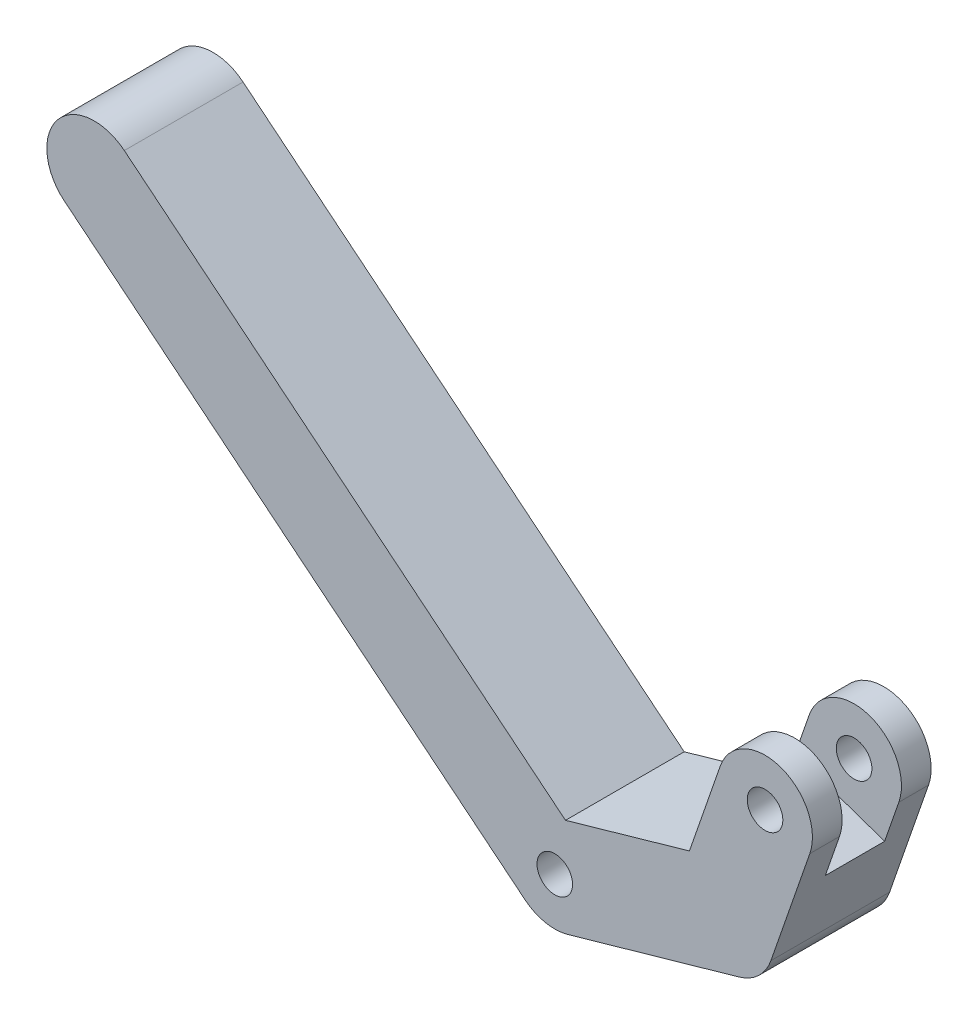
from build123d import *

# Parameters (mm, degrees)
Y_KSEKLIK_EKSTR_ZYON1_DEPTH = 5
IZIM2_R                     = 1.5
KES_EKSTR_ZYON1_DEPTH       = 15
KES_EKSTR_ZYON2_DEPTH       = 2.5


with BuildPart() as part:
    # Çizim1 → Yükseklik-Ekstrüzyon1 (new, symmetric)
    with BuildSketch(Plane.XY):
        with BuildLine():
            Line((-41.30834423, 28.453834486), (-2.524523213, -3.102705681))
            ThreePointArc((-2.524523213, -3.102705681), (-0.805425984, -3.9180721), (1.095904798, -3.846945889))
            Line((1.095904798, -3.846945889), (15.52194925, 0.262696355))
            ThreePointArc((15.52194925, 0.262696355), (17.169826346, 1.200432935), (18.198993637, 2.792809619))
            Line((18.198993637, 2.792809619), (21.476713619, 12.240378181))
            ThreePointArc((21.476713619, 12.240378181), (19.014364959, 17.318962653), (13.935780486, 14.856613993))
            Line((13.935780486, 14.856613993), (11.337646141, 7.367855803))
            Line((11.337646141, 7.367855803), (0.900459327, 4.382653193))
            Line((0.900459327, 4.382653193), (-36.257215818, 34.657550675))
            ThreePointArc((-36.257215818, 34.657550675), (-41.885679286, 34.082104516), (-41.30834423, 28.453834486))
        make_face()
    extrude(amount=Y_KSEKLIK_EKSTR_ZYON1_DEPTH, both=True)

    # Çizim2 → Kes-Ekstrüzyon1 (cut)
    with BuildSketch(Plane.XY.offset(5)):
        with Locations((17.706247053, 13.548496087)):
            Circle(IZIM2_R)
        Circle(IZIM2_R)
    extrude(amount=-KES_EKSTR_ZYON1_DEPTH, mode=Mode.SUBTRACT)

    # Çizim3 → Kes-Ekstrüzyon2 (cut, symmetric)
    with BuildSketch(Plane.XY):
        with BuildLine():
            Line((12.739401972, 11.408220568), (20.280335105, 8.791984755))
            Line((20.280335105, 8.791984755), (21.476713619, 12.240378181))
            ThreePointArc((21.476713619, 12.240378181), (19.014364959, 17.318962653), (13.935780486, 14.856613993))
            Line((13.935780486, 14.856613993), (12.739401972, 11.408220568))
        make_face()
    extrude(amount=KES_EKSTR_ZYON2_DEPTH, both=True, mode=Mode.SUBTRACT)


solid = part.part
